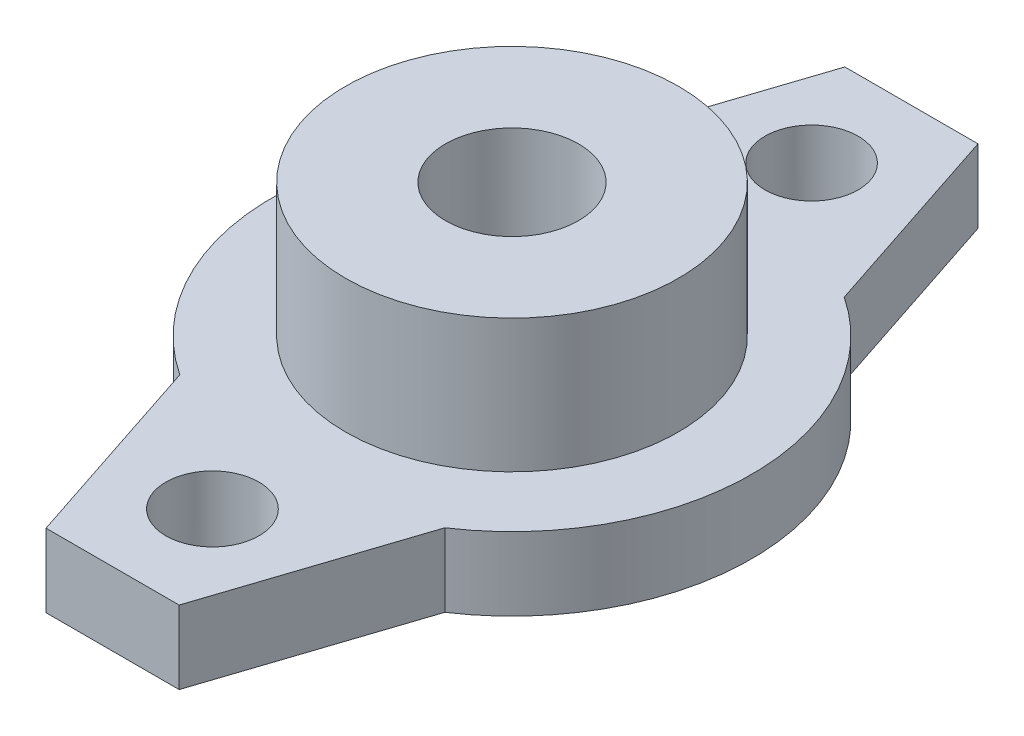
from build123d import *

# Parameters (mm, degrees)
BOSS_EXTRU_1_DEPTH      = 5.5
ESQUISSE2_R             = 12.5
ESQUISSE2_R_2           = 5
BOSS_EXTRU_2_DEPTH      = 10
ENL_V_START             = -10
ESQUISSE3_R             = 5
ENL_V_MAT_EXTRU_1_DEPTH = 10
ESQUISSE4_R             = 3.5
ENL_V_MAT_EXTRU_2_DEPTH = 10
D_GAGEMENT_M61_D        = 7
D_GAGEMENT_M61_DEPTH    = 120
D_GAGEMENT_M61_TIP      = 2.103012167
D_GAGEMENT_M62_D        = 7
D_GAGEMENT_M62_DEPTH    = 120
D_GAGEMENT_M62_TIP      = 2.103012167


with BuildPart() as part:
    # Esquisse1 → Boss.-Extru.1 (new body)
    with BuildSketch(Plane(origin=(0, 0, 0), x_dir=(1, 0, 0), z_dir=(0, 1, 0))):
        with BuildLine():
            Line((-9.949874371, 15), (-5, 30))
            Line((-5, 30), (5, 30))
            Line((5, 30), (9.949874371, 15))
            ThreePointArc((9.949874371, 15), (18, 0), (9.949874371, -15))
            Line((9.949874371, -15), (5, -30))
            Line((5, -30), (-5, -30))
            Line((-5, -30), (-9.949874371, -15))
            ThreePointArc((-9.949874371, -15), (-18, 0), (-9.949874371, 15))
        make_face()
    extrude(amount=BOSS_EXTRU_1_DEPTH)

    # Esquisse2 → Boss.-Extru.2 (add)
    with BuildSketch(Plane(origin=(0, 5.5, 0), x_dir=(1, 0, 0), z_dir=(0, 1, 0))):
        with Locations(Location((0, 0, 0), (0, 0, 90))):
            Circle(ESQUISSE2_R)
        with Locations(Location((0, 0, 0), (0, 0, 270))):
            Circle(ESQUISSE2_R_2, mode=Mode.SUBTRACT)
    extrude(amount=BOSS_EXTRU_2_DEPTH)

    # Esquisse3 → Enlèv. mat.-Extru.1 (cut)
    with BuildSketch(Plane(origin=(0, 5.5, 0), x_dir=(1, 0, 0), z_dir=(0, 1, 0)).offset(ENL_V_START)):
        with Locations(Location((0, 0, 0), (0, 0, 90))):
            Circle(ESQUISSE3_R)
    extrude(amount=ENL_V_MAT_EXTRU_1_DEPTH, mode=Mode.SUBTRACT)

    # Esquisse4 → Enlèv. mat.-Extru.2 (cut)
    with BuildSketch(Plane(origin=(0, 5.5, 0), x_dir=(1, 0, 0), z_dir=(0, 1, 0))):
        with Locations(Location((0, 22.5, 0), (0, 0, 270))):
            Circle(ESQUISSE4_R)
        with Locations(Location((0, -22.5, 0), (0, 0, 270))):
            Circle(ESQUISSE4_R)
    extrude(amount=-ENL_V_MAT_EXTRU_2_DEPTH, mode=Mode.SUBTRACT)

    # Dégagement M61
    with Locations(Plane(origin=(0, 0, 0), x_dir=(0, 0, -1), z_dir=(0, 1, 0))):
        with Locations((22.5, 0), (-22.5, 0)):
            Hole(D_GAGEMENT_M61_D / 2, depth=D_GAGEMENT_M61_DEPTH)
            with Locations((0, 0, -(D_GAGEMENT_M61_DEPTH + D_GAGEMENT_M61_TIP / 2))):  # 118° drill point
                Cone(0, D_GAGEMENT_M61_D / 2, D_GAGEMENT_M61_TIP, mode=Mode.SUBTRACT)

    # Dégagement M62
    with Locations(Plane(origin=(0, -60, 0), x_dir=(0, 0, 1), z_dir=(0, -1, 0))):
        with Locations((22.5, 0), (-22.5, 0)):
            Hole(D_GAGEMENT_M62_D / 2, depth=D_GAGEMENT_M62_DEPTH)
            with Locations((0, 0, -(D_GAGEMENT_M62_DEPTH + D_GAGEMENT_M62_TIP / 2))):  # 118° drill point
                Cone(0, D_GAGEMENT_M62_D / 2, D_GAGEMENT_M62_TIP, mode=Mode.SUBTRACT)


solid = part.part
